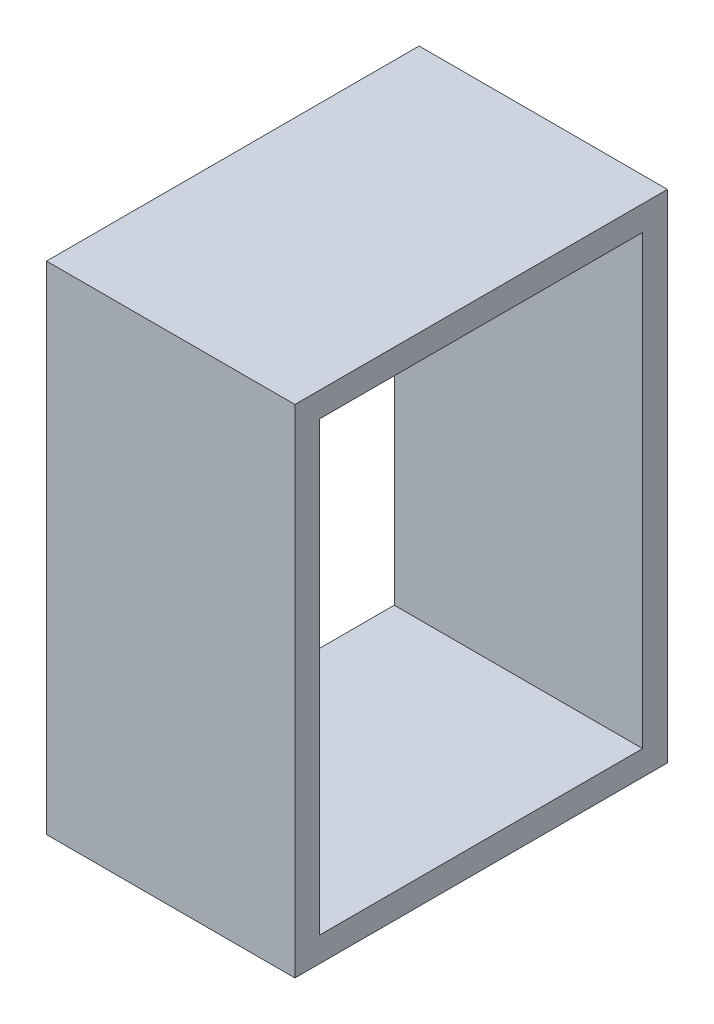
from build123d import *

# Parameters (mm, degrees)
SKETCH_1_W      = 150
SKETCH_1_H      = 200
SKETCH_1_W_2    = 130
SKETCH_1_H_2    = 180
EXTRUDE_1_DEPTH = 100


with BuildPart() as part:
    # Эскиз1 → Бобышка-Вытянуть1 (new body)
    with BuildSketch(Plane(origin=(0, 0, 0), x_dir=(0, 0, -1), z_dir=(1, 0, 0))):
        with Locations((75, 100)):
            Rectangle(SKETCH_1_W, SKETCH_1_H)
        with Locations((75, 100)):
            Rectangle(SKETCH_1_W_2, SKETCH_1_H_2, mode=Mode.SUBTRACT)
    extrude(amount=EXTRUDE_1_DEPTH)


solid = part.part
